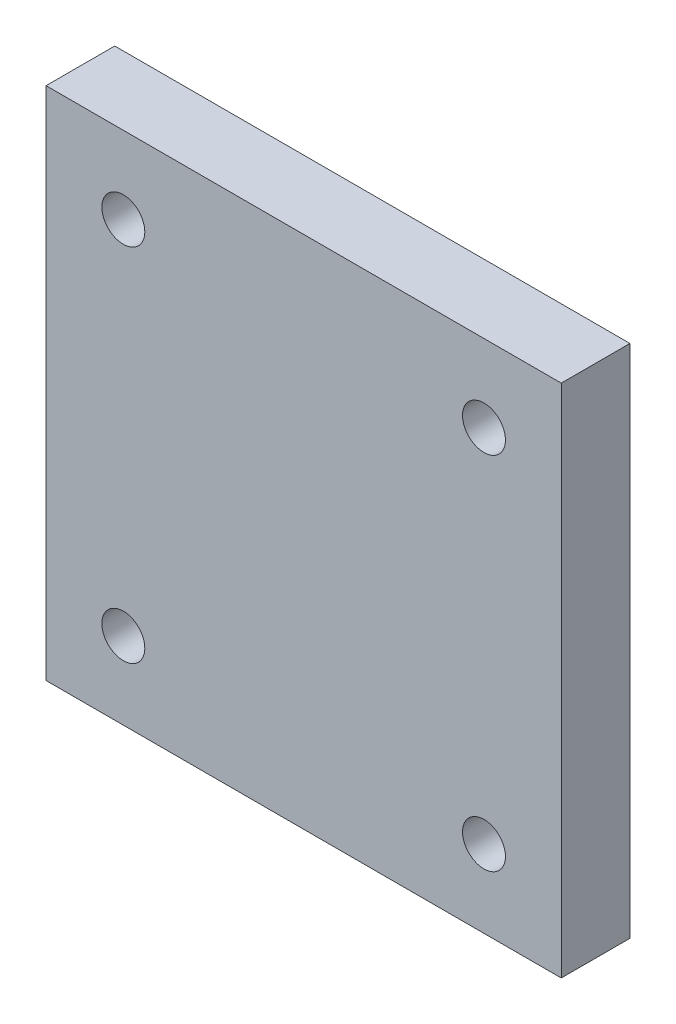
from build123d import *

# Parameters (mm, degrees)
SZKIC1_W                    = 60
SZKIC1_H                    = 60
DODANIE_WYCI_GNI_CIE1_DEPTH = 8
OTW_R_GWINTOWANY_M6X1_01_D  = 5


with BuildPart() as part:
    # Szkic1 → Dodanie-wyciągnięcie1 (new body)
    with BuildSketch(Plane.XY):
        with Locations((-40, 330)):
            Rectangle(SZKIC1_W, SZKIC1_H)
    extrude(amount=DODANIE_WYCI_GNI_CIE1_DEPTH)

    # Otwór gwintowany M6x1.01 (through all)
    with Locations(Plane.XY.offset(8)):
        with Locations((-19, 351), (-61, 351), (-61, 309), (-19, 309)):
            Hole(OTW_R_GWINTOWANY_M6X1_01_D / 2)


solid = part.part
